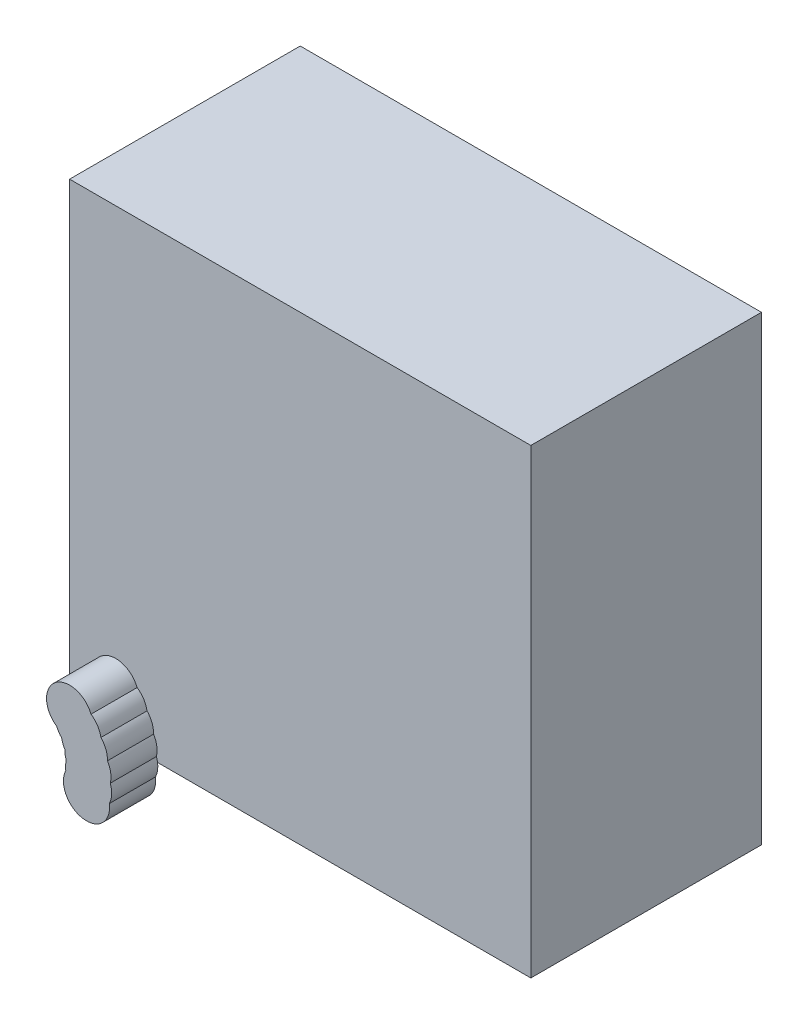
from build123d import *

# Parameters (mm, degrees)
SKETCH_1_W            = 20
SKETCH_1_H            = 20
BASEBOX_DEPTH         = 10
SKETCH_2_R            = 1
BOSSSEED_DEPTH        = 2
CIRCULARPATTERN_COUNT = 6
CIRCULARPATTERN_ANGLE = 60


with BuildPart() as part:
    # 草图1 → BaseBox (new body)
    with BuildSketch(Plane.XY):
        with Locations((10, 10)):
            Rectangle(SKETCH_1_W, SKETCH_1_H)
    extrude(amount=BASEBOX_DEPTH)

    # 草图2 → BossSeed (add)
    with BuildSketch(Plane.XY.offset(10)):
        with Locations((2, 2)):
            Circle(SKETCH_2_R)
    bossseed = extrude(amount=BOSSSEED_DEPTH)

    # CircularPattern: BossSeed ×6 about axis
    circularpattern_axis = Axis((0, 0, 0), (0, 0, -1))
    for i in range(1, CIRCULARPATTERN_COUNT):
        add(bossseed.rotate(circularpattern_axis, i * CIRCULARPATTERN_ANGLE / (CIRCULARPATTERN_COUNT - 1)))


solid = part.part
